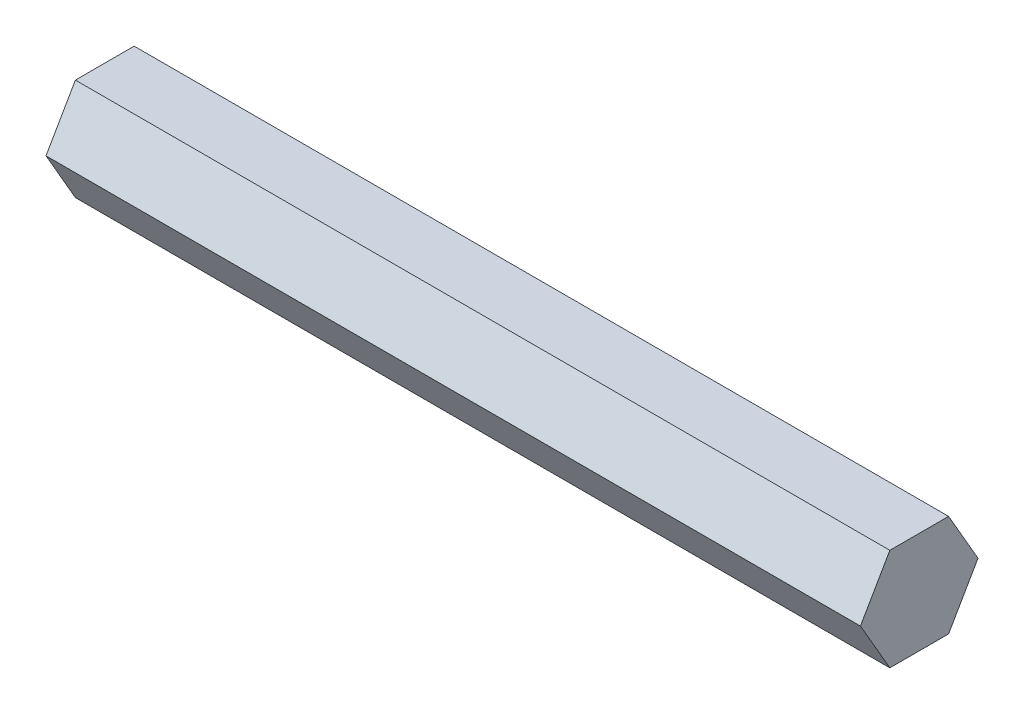
from build123d import *

# Parameters (mm, degrees)
BOSS_EXTRUDE1_DEPTH = 50.8


with BuildPart() as part:
    # Sketch1 → Boss-Extrude1 (new, symmetric)
    with BuildSketch(Plane(origin=(0, 0, 0), x_dir=(0, 0, -1), z_dir=(1, 0, 0))):
        Polygon((7.332348419, 0), (3.666174209, 6.35), (-3.666174209, 6.35), (-7.332348419, 0), (-3.666174209, -6.35), (3.666174209, -6.35), align=None)
    extrude(amount=BOSS_EXTRUDE1_DEPTH, both=True)


solid = part.part
